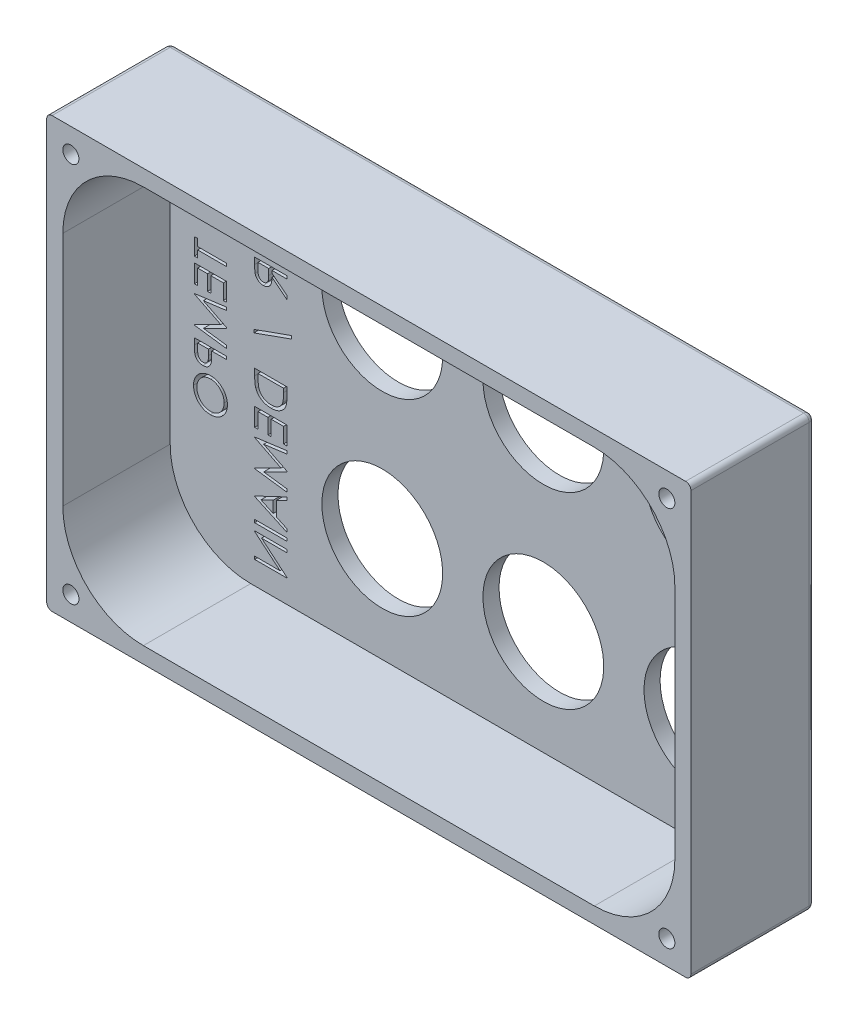
from build123d import *

# Parameters (mm, degrees)
ESQUISSE1_W             = 120
ESQUISSE1_H             = 80
BOSS_EXTRU_1_DEPTH      = 3
ESQUISSE4_W             = 120
ESQUISSE4_H             = 80
ESQUISSE4_W_2           = 114
ESQUISSE4_H_2           = 74
BOSS_EXTRU_3_DEPTH      = 20
CONG_1_R                = 15
ESQUISSE5_R             = 1.5
ENL_V_MAT_EXTRU_1_DEPTH = 15
ESQUISSE6_R             = 11.25
ESQUISSE6_W             = 6
ESQUISSE6_H             = 0.538461539
ENL_V_MAT_EXTRU_2_DEPTH = 147.044513762
CONG_2_R                = 1


with BuildPart() as part:
    # Esquisse1 → Boss.-Extru.1 (new body)
    with BuildSketch(Plane.XY):
        with Locations((60, 40)):
            Rectangle(ESQUISSE1_W, ESQUISSE1_H)
    extrude(amount=BOSS_EXTRU_1_DEPTH)

    # Esquisse4 → Boss.-Extru.3 (add)
    with BuildSketch(Plane.XY.offset(3)):
        with Locations((60, 40)):
            Rectangle(ESQUISSE4_W, ESQUISSE4_H)
        with Locations((60, 40)):
            Rectangle(ESQUISSE4_W_2, ESQUISSE4_H_2, mode=Mode.SUBTRACT)
    extrude(amount=BOSS_EXTRU_3_DEPTH)

    # Congé1
    cong_1_edges = [part.edges().sort_by_distance(p)[0] for p in [
        (3, 3, 13),
        (117, 3, 13),
        (117, 77, 13),
        (3, 77, 13),
    ]]
    fillet(cong_1_edges, radius=CONG_1_R)

    # Esquisse5 → Enlèv. mat.-Extru.1 (cut)
    with BuildSketch(Plane.XY.offset(23)):
        with Locations((4.5, 75.5)):
            Circle(ESQUISSE5_R)
        with Locations((115.5, 75.5)):
            Circle(ESQUISSE5_R)
        with Locations((115.5, 4.5)):
            Circle(ESQUISSE5_R)
        with Locations((4.5, 4.5)):
            Circle(ESQUISSE5_R)
    extrude(amount=-ENL_V_MAT_EXTRU_1_DEPTH, mode=Mode.SUBTRACT)

    # Esquisse6 → Enlèv. mat.-Extru.2 (cut, through all)
    # profile 1 of 22: a face of its own
    with BuildSketch(Plane(origin=(0, 0, 0), x_dir=(-1, 0, 0), z_dir=(0, 0, -1))):
        with Locations((-102.5, 57.5)):
            Circle(ESQUISSE6_R)
    # profile 2 of 22: a face of its own
    with BuildSketch(Plane(origin=(0, 0, 0), x_dir=(-1, 0, 0), z_dir=(0, 0, -1))):
        with Locations((-72.5, 57.5)):
            Circle(ESQUISSE6_R)
    # profile 3 of 22: a face of its own
    with BuildSketch(Plane(origin=(0, 0, 0), x_dir=(-1, 0, 0), z_dir=(0, 0, -1))):
        with Locations((-42.5, 57.5)):
            Circle(ESQUISSE6_R)
    # profile 4 of 22: a face of its own
    with BuildSketch(Plane(origin=(0, 0, 0), x_dir=(-1, 0, 0), z_dir=(0, 0, -1))):
        with Locations((-42.5, 22.5)):
            Circle(ESQUISSE6_R)
    # profile 5 of 22: a face of its own
    with BuildSketch(Plane(origin=(0, 0, 0), x_dir=(-1, 0, 0), z_dir=(0, 0, -1))):
        with Locations((-72.5, 22.5)):
            Circle(ESQUISSE6_R)
    # profile 6 of 22: a face of its own
    with BuildSketch(Plane(origin=(0, 0, 0), x_dir=(-1, 0, 0), z_dir=(0, 0, -1))):
        with Locations((-102.5, 22.5)):
            Circle(ESQUISSE6_R)
    # profile 7 of 22: a face of its own
    with BuildSketch(Plane(origin=(0, 0, 0), x_dir=(-1, 0, 0), z_dir=(0, 0, -1))):
        Polygon((-8.115384615, 53.730769231), (-7.5, 53.730769231), (-7.5, 50.576923077), (-8.115384615, 50.576923077), (-8.115384615, 51.884615385), (-13.5, 51.884615385), (-13.5, 52.423076923), (-8.115384615, 52.423076923), align=None)
    # profile 8 of 22: a face of its own
    with BuildSketch(Plane(origin=(0, 0, 0), x_dir=(-1, 0, 0), z_dir=(0, 0, -1))):
        Polygon((-7.5, 49.5), (-7.5, 46.115384615), (-8.115384615, 46.115384615), (-8.115384615, 48.961538462), (-9.961538462, 48.961538462), (-9.961538462, 46.115384615), (-10.576923077, 46.115384615), (-10.576923077, 48.961538462), (-12.884615385, 48.961538462), (-12.884615385, 46.115384615), (-13.5, 46.115384615), (-13.5, 49.5), align=None)
    # profile 9 of 22: a face of its own
    with BuildSketch(Plane(origin=(0, 0, 0), x_dir=(-1, 0, 0), z_dir=(0, 0, -1))):
        Polygon((-13.5, 45.346153846), (-7.5, 44.554086538), (-7.5, 44.477163462), (-12.423076923, 42), (-7.5, 39.528846154), (-7.5, 39.450721154), (-13.5, 38.653846154), (-13.5, 39.194711538), (-9.182692308, 39.769230769), (-13.5, 41.935096154), (-13.5, 42.056490385), (-9.173076923, 44.230769231), (-13.5, 44.804086538), align=None)
    # profile 10 of 22: a face of its own
    with BuildSketch(Plane(origin=(0, 0, 0), x_dir=(-1, 0, 0), z_dir=(0, 0, -1))):
        with BuildLine():
            Line((-7.5, 37.423076923), (-7.5, 36.246394231))
            add(Edge.make_bspline(
                [(-7.5, 36.246394231), (-7.500088965, 36.165461249), (-7.500259426, 36.010390061), (-7.505427562, 35.788021394), (-7.512330462, 35.586061854), (-7.521899422, 35.404946916), (-7.533207862, 35.244119319), (-7.549068501, 35.104306805), (-7.565629008, 34.984410423), (-7.582465705, 34.912570795), (-7.590144231, 34.879807692)],
                knots=[0, 0, 0, 0, 1.415646017, 2.712440637, 3.8905458, 4.950247383, 5.884950622, 6.709939814, 7.411656543, 8, 8, 8, 8], degree=3))
            add(Edge.make_bspline(
                [(-7.590144231, 34.879807692), (-7.601496043, 34.838332965), (-7.623932178, 34.756360811), (-7.668871455, 34.638246153), (-7.722149727, 34.525862874), (-7.78289659, 34.418856785), (-7.853597499, 34.318427058), (-7.932015981, 34.223288125), (-8.018108893, 34.132894297), (-8.11354521, 34.050316225), (-8.214806223, 33.974292507), (-8.324147069, 33.90907569), (-8.439187988, 33.853910872), (-8.561107138, 33.808858018), (-8.689163527, 33.77460047), (-8.823730992, 33.749289912), (-8.964347147, 33.733095902), (-9.060451825, 33.731554102), (-9.109375, 33.730769231)],
                knots=[0, 0, 0, 0, 0.999487232, 1.975422798, 2.933948774, 3.889618007, 4.832992075, 5.786114792, 6.754729845, 7.731954186, 8.717668599, 9.695514499, 10.68728626, 11.680675814, 12.71351902, 13.766008651, 14.862761406, 16, 16, 16, 16], degree=3))
            add(Edge.make_bspline(
                [(-9.109375, 33.730769231), (-9.158708332, 33.731491673), (-9.255232327, 33.73290518), (-9.396442821, 33.749870241), (-9.531388633, 33.772721998), (-9.659770548, 33.807859802), (-9.780826154, 33.853880956), (-9.896405409, 33.907867332), (-10.00454199, 33.972981956), (-10.105628477, 34.047801664), (-10.199759755, 34.131032969), (-10.286253688, 34.22232372), (-10.364603983, 34.321305364), (-10.434986286, 34.427663332), (-10.49576848, 34.542434502), (-10.550209574, 34.663878193), (-10.595931392, 34.793049993), (-10.619982926, 34.88243716), (-10.632211538, 34.927884615)],
                knots=[0, 0, 0, 0, 1.121902311, 2.195077645, 3.232258892, 4.234102512, 5.217864754, 6.176164875, 7.132989551, 8.084763148, 9.034132444, 9.988522005, 10.94243251, 11.903244335, 12.886203696, 13.894208494, 14.929344452, 16, 16, 16, 16], degree=3))
            add(Edge.make_bspline(
                [(-10.632211538, 34.927884615), (-10.64020522, 34.965474331), (-10.657723839, 35.047854378), (-10.677281193, 35.183527616), (-10.693974223, 35.341491134), (-10.706490459, 35.521529329), (-10.717205376, 35.723480594), (-10.725722109, 35.947454178), (-10.730401858, 36.193889739), (-10.730643217, 36.3657833), (-10.730769231, 36.455528846)],
                knots=[0, 0, 0, 0, 0.601384939, 1.31797006, 2.144135048, 3.087295005, 4.142315834, 5.309527816, 6.595305764, 8, 8, 8, 8], degree=3))
            Line((-10.730769231, 36.455528846), (-10.730769231, 36.884615385))
            Line((-10.730769231, 36.884615385), (-13.5, 36.884615385))
            Line((-13.5, 36.884615385), (-13.5, 37.423076923))
            Line((-13.5, 37.423076923), (-7.5, 37.423076923))
        make_face()
        with BuildLine():
            Line((-8.115384615, 36.884615385), (-10.115384615, 36.884615385))
            Line((-10.115384615, 36.884615385), (-10.128605769, 35.834134615))
            add(Edge.make_bspline(
                [(-10.128605769, 35.834134615), (-10.128637844, 35.782842812), (-10.128699765, 35.683825044), (-10.121774213, 35.540398765), (-10.114134866, 35.407673625), (-10.102171319, 35.285361393), (-10.086408222, 35.174396787), (-10.069250393, 35.073354503), (-10.046004948, 34.983713748), (-10.013592872, 34.878671196), (-9.959390835, 34.762019031), (-9.878687958, 34.635956406), (-9.778642135, 34.527390792), (-9.664610277, 34.434070495), (-9.537293276, 34.361747513), (-9.402140338, 34.307351409), (-9.259066419, 34.275665991), (-9.161208482, 34.271390426), (-9.111778846, 34.269230769)],
                knots=[0, 0, 0, 0, 1.160368111, 2.240066715, 3.248291599, 4.168343349, 5.019594299, 5.784185847, 6.485545725, 7.113397927, 8.269509094, 9.383373363, 10.487084095, 11.595623793, 12.704274681, 13.786671823, 14.88201193, 16, 16, 16, 16], degree=3))
            add(Edge.make_bspline(
                [(-9.111778846, 34.269230769), (-9.063545143, 34.271401959), (-8.967662511, 34.275718015), (-8.827072188, 34.307601341), (-8.693353171, 34.361641326), (-8.567603602, 34.434560567), (-8.45403842, 34.52520134), (-8.356250477, 34.631361039), (-8.276570475, 34.750871953), (-8.225496436, 34.862100272), (-8.194260192, 34.960836394), (-8.172414332, 35.046607594), (-8.154969664, 35.143448077), (-8.14084504, 35.25139305), (-8.128753319, 35.369604701), (-8.120548809, 35.499098975), (-8.115746306, 35.639385214), (-8.115508098, 35.736774765), (-8.115384615, 35.787259615)],
                knots=[0, 0, 0, 0, 1.120550889, 2.227516482, 3.330715807, 4.461473166, 5.594337325, 6.694900473, 7.802844763, 8.919519911, 9.52614448, 10.208195984, 10.975273469, 11.811520316, 12.738076669, 13.736566072, 14.826679847, 16, 16, 16, 16], degree=3))
            Line((-8.115384615, 35.787259615), (-8.115384615, 36.884615385))
        make_face(mode=Mode.SUBTRACT)
    # profile 11 of 22: a face of its own
    with BuildSketch(Plane(origin=(0, 0, 0), x_dir=(-1, 0, 0), z_dir=(0, 0, -1))):
        with BuildLine():
            add(Edge.make_bspline(
                [(-7.346153846, 29.692307692), (-7.348967836, 29.581208105), (-7.354494745, 29.362999348), (-7.396801416, 29.042299206), (-7.469994848, 28.736137349), (-7.567469376, 28.442012866), (-7.697523453, 28.163469156), (-7.854630567, 27.89831514), (-8.04102515, 27.647300508), (-8.253579589, 27.412726113), (-8.485690502, 27.198856319), (-8.734108761, 27.011999753), (-8.995432666, 26.854013938), (-9.270571555, 26.724524044), (-9.558314443, 26.622846137), (-9.860297385, 26.552705516), (-10.174536154, 26.507895534), (-10.388868097, 26.502657296), (-10.497596154, 26.5)],
                knots=[0, 0, 0, 0, 1.06508495, 2.091914715, 3.094501328, 4.079693967, 5.057647778, 6.035986298, 7.030177474, 8.050107388, 9.066943579, 10.051896531, 11.025616101, 11.9896488, 12.96281505, 13.945825876, 14.957941789, 16, 16, 16, 16], degree=3))
            add(Edge.make_bspline(
                [(-10.497596154, 26.5), (-10.605523298, 26.502656902), (-10.818260202, 26.507893964), (-11.130504772, 26.552756517), (-11.430665151, 26.623105942), (-11.718211115, 26.723580853), (-11.993554116, 26.852448678), (-12.255358361, 27.011502246), (-12.505496693, 27.197121701), (-12.738734399, 27.410252272), (-12.953024337, 27.642307833), (-13.140171415, 27.891426614), (-13.30010241, 28.152493337), (-13.428704145, 28.427465899), (-13.531101653, 28.713278811), (-13.600981957, 29.012551538), (-13.646040377, 29.323948698), (-13.651215677, 29.536298567), (-13.653846154, 29.644230769)],
                knots=[0, 0, 0, 0, 1.04355943, 2.056976533, 3.044937463, 4.02179873, 4.997890911, 5.980248884, 6.980147982, 8.006253959, 9.032111064, 10.031228745, 11.015595249, 11.988180414, 12.962670953, 13.946861971, 14.95644057, 16, 16, 16, 16], degree=3))
            add(Edge.make_bspline(
                [(-13.653846154, 29.644230769), (-13.651190419, 29.752958386), (-13.645955257, 29.967289461), (-13.601067738, 30.28192133), (-13.530901389, 30.584122927), (-13.430530934, 30.872963777), (-13.301302242, 31.148538667), (-13.142499372, 31.410820942), (-12.955371999, 31.660125779), (-12.742525183, 31.893916209), (-12.510358099, 32.107569058), (-12.262876787, 32.295489076), (-12.002434938, 32.453376415), (-11.730106142, 32.582659659), (-11.446594322, 32.684917783), (-11.150116082, 32.754703934), (-10.842332752, 32.799849527), (-10.632773679, 32.805052362), (-10.526442308, 32.807692308)],
                knots=[0, 0, 0, 0, 1.053167129, 2.076072758, 3.073341244, 4.055601477, 5.033424535, 6.017524495, 7.021518915, 8.049444456, 9.077120685, 10.074910483, 11.055688766, 12.022980584, 12.991883888, 13.970269434, 14.970104079, 16, 16, 16, 16], degree=3))
            add(Edge.make_bspline(
                [(-10.526442308, 32.807692308), (-10.455071692, 32.80677663), (-10.313230832, 32.804956827), (-10.102607174, 32.783015845), (-9.895348058, 32.751242131), (-9.692150191, 32.705467222), (-9.492980389, 32.646421472), (-9.298245967, 32.573657603), (-9.106342885, 32.490270181), (-8.920923398, 32.390985936), (-8.741696478, 32.282663854), (-8.570903209, 32.164549507), (-8.411594419, 32.035819346), (-8.261210272, 31.898312253), (-8.122317482, 31.75012482), (-7.991887868, 31.593487265), (-7.871271588, 31.427579987), (-7.763001917, 31.252140601), (-7.663554909, 31.071642), (-7.58052484, 30.884774659), (-7.507137395, 30.695481289), (-7.448816138, 30.502094522), (-7.402403735, 30.305061692), (-7.370867679, 30.104136488), (-7.348877946, 29.899525858), (-7.347065786, 29.761677599), (-7.346153846, 29.692307692)],
                knots=[0, 0, 0, 0, 1.037115869, 2.061148057, 3.07517727, 4.084041727, 5.086514338, 6.092668487, 7.104487461, 8.125783165, 9.147610153, 10.147694368, 11.141876323, 12.122903372, 13.107606018, 14.091946891, 15.084523921, 16.086505767, 17.087268121, 18.077809654, 19.05670789, 20.036870126, 21.011670792, 21.99694167, 22.991993299, 24, 24, 24, 24], degree=3))
        make_face()
        with BuildLine():
            add(Edge.make_bspline(
                [(-7.961538462, 29.665865385), (-7.962232229, 29.722804886), (-7.963613131, 29.836139544), (-7.981816386, 30.004625399), (-8.007734943, 30.170904521), (-8.044800467, 30.334967862), (-8.09483758, 30.495932534), (-8.153795643, 30.655405988), (-8.223150871, 30.812622488), (-8.304020792, 30.965824466), (-8.392362399, 31.114755844), (-8.489320375, 31.256253045), (-8.594424575, 31.388904538), (-8.706286643, 31.513135253), (-8.826044733, 31.628583185), (-8.951787496, 31.737588541), (-9.087134746, 31.835764155), (-9.228409419, 31.925739649), (-9.375429355, 32.006255888), (-9.52664624, 32.077853654), (-9.683293709, 32.136420522), (-9.843672263, 32.184184597), (-10.007527908, 32.223784272), (-10.176103649, 32.248871), (-10.348552413, 32.26726933), (-10.465092734, 32.268571922), (-10.524038462, 32.269230769)],
                knots=[0, 0, 0, 0, 1.008585988, 2.007529826, 2.999688727, 3.990042337, 4.984966365, 5.984641633, 7.001812546, 8.027570247, 9.052811818, 10.068991095, 11.064725446, 12.050001529, 13.029093193, 14.010961114, 14.996492974, 15.989185205, 16.977398719, 17.96520407, 18.951579521, 19.937648295, 20.929603947, 21.935788061, 22.955928099, 24, 24, 24, 24], degree=3))
            add(Edge.make_bspline(
                [(-10.524038462, 32.269230769), (-10.610716554, 32.267045292), (-10.781239178, 32.262745781), (-11.031127424, 32.225104232), (-11.271278772, 32.167123705), (-11.500379188, 32.081653934), (-11.720397959, 31.974767166), (-11.929383281, 31.842721068), (-12.127391637, 31.686276921), (-12.31304067, 31.508568018), (-12.48249062, 31.314300521), (-12.631227892, 31.108015842), (-12.757074034, 30.891923943), (-12.859597016, 30.66546131), (-12.940836566, 30.429836957), (-12.996514219, 30.183532584), (-13.033157857, 29.928188939), (-13.036676867, 29.754136387), (-13.038461538, 29.665865385)],
                knots=[0, 0, 0, 0, 1.032063989, 2.030389145, 3.003944642, 3.970395727, 4.937377036, 5.913328081, 6.909231446, 7.93887556, 8.970685674, 9.976071282, 10.964166581, 11.944589148, 12.933237628, 13.927779006, 14.949070134, 16, 16, 16, 16], degree=3))
            add(Edge.make_bspline(
                [(-13.038461538, 29.665865385), (-13.037646391, 29.606534809), (-13.036029707, 29.488864457), (-13.019746226, 29.313843587), (-12.993634582, 29.141975702), (-12.956038684, 28.973502423), (-12.908988136, 28.808612903), (-12.853082449, 28.646626548), (-12.783368568, 28.489240219), (-12.706219406, 28.33457633), (-12.61890147, 28.186505288), (-12.523298773, 28.046021848), (-12.420074246, 27.913940451), (-12.309183571, 27.789975016), (-12.191582657, 27.67372716), (-12.06424779, 27.568353497), (-11.930897732, 27.469001755), (-11.789293536, 27.379386534), (-11.641963787, 27.299030375), (-11.490174112, 27.229155712), (-11.334446162, 27.169839473), (-11.174515996, 27.121964356), (-11.010697873, 27.084445795), (-10.84276961, 27.058594674), (-10.671067915, 27.04051159), (-10.554935586, 27.039148607), (-10.496394231, 27.038461538)],
                knots=[0, 0, 0, 0, 1.047226202, 2.076964084, 3.100341814, 4.114585567, 5.122123135, 6.126552355, 7.137064942, 8.158803602, 9.176592812, 10.169297945, 11.156925011, 12.133779169, 13.104132798, 14.073170763, 15.049307625, 16.038276215, 17.028988595, 18.010110019, 18.986169996, 19.968539974, 20.955178716, 21.950601663, 22.966915103, 24, 24, 24, 24], degree=3))
            add(Edge.make_bspline(
                [(-10.496394231, 27.038461538), (-10.438253366, 27.039149161), (-10.322920252, 27.040513186), (-10.152415992, 27.058586), (-9.985696201, 27.08447324), (-9.823415395, 27.12178074), (-9.66553221, 27.169866718), (-9.512194928, 27.229159284), (-9.362832308, 27.29907694), (-9.217813513, 27.379319611), (-9.078656819, 27.469518165), (-8.945624113, 27.568079725), (-8.821213695, 27.676706035), (-8.702354236, 27.792293511), (-8.591580649, 27.917729297), (-8.488856565, 28.052445297), (-8.391701476, 28.194805629), (-8.304061118, 28.345539024), (-8.223109473, 28.501096378), (-8.153812628, 28.660733966), (-8.094582595, 28.822923008), (-8.045005279, 28.986833102), (-8.007698629, 29.153618929), (-7.981825685, 29.322309226), (-7.963611181, 29.493192326), (-7.962231561, 29.608125048), (-7.961538462, 29.665865385)],
                knots=[0, 0, 0, 0, 1.029967493, 2.04313025, 3.035375922, 4.01889446, 4.991458755, 5.958017022, 6.930036849, 7.912118993, 8.892942568, 9.867138445, 10.843712051, 11.817804417, 12.803729339, 13.806387533, 14.818654169, 15.856205545, 16.894655496, 17.924916651, 18.938004761, 19.953404357, 20.957695443, 21.963967554, 22.97713031, 24, 24, 24, 24], degree=3))
        make_face(mode=Mode.SUBTRACT)
    # profile 12 of 22: a face of its own
    with BuildSketch(Plane(origin=(0, 0, 0), x_dir=(-1, 0, 0), z_dir=(0, 0, -1))):
        with BuildLine():
            Line((-18.730769231, 70.807692308), (-18.730769231, 70.269230769))
            Line((-18.730769231, 70.269230769), (-22.782451923, 70.269230769))
            add(Edge.make_bspline(
                [(-22.782451923, 70.269230769), (-22.857375659, 70.269764387), (-23.001238373, 70.270788999), (-23.208443057, 70.276530478), (-23.397675642, 70.286846261), (-23.5691735, 70.302798821), (-23.722906187, 70.321178039), (-23.859385065, 70.345020955), (-23.977932339, 70.373213188), (-24.110982869, 70.415919645), (-24.257384903, 70.485556841), (-24.41423426, 70.592327354), (-24.552555077, 70.722768424), (-24.672227919, 70.87425159), (-24.767660981, 71.047605774), (-24.836149807, 71.239439783), (-24.877930035, 71.448522981), (-24.882342215, 71.593550539), (-24.884615385, 71.668269231)],
                knots=[0, 0, 0, 0, 1.237549021, 2.376245131, 3.423509879, 4.367128923, 5.220764738, 5.980167839, 6.654279555, 7.23186528, 8.285695362, 9.319068926, 10.353713031, 11.414109097, 12.495220016, 13.606748513, 14.766988686, 16, 16, 16, 16], degree=3))
            add(Edge.make_bspline(
                [(-24.884615385, 71.668269231), (-24.882822601, 71.726893917), (-24.879239886, 71.844049987), (-24.848267577, 72.018648468), (-24.802341071, 72.192344946), (-24.732894821, 72.366297076), (-24.640042343, 72.544184019), (-24.517936463, 72.728569956), (-24.367391164, 72.921646672), (-24.252465904, 73.048816777), (-24.192307692, 73.115384615)],
                knots=[0, 0, 0, 0, 0.854372818, 1.707385869, 2.579105618, 3.471016644, 4.432770875, 5.500780854, 6.691771033, 8, 8, 8, 8], degree=3))
            Line((-24.192307692, 73.115384615), (-23.730769231, 72.798076923))
            add(Edge.make_bspline(
                [(-23.730769231, 72.798076923), (-23.781156652, 72.724815858), (-23.87610123, 72.586770672), (-23.999912408, 72.384330377), (-24.103982359, 72.203720172), (-24.157828637, 72.085731569), (-24.182692308, 72.03125)],
                knots=[0, 0, 0, 0, 1.196704426, 2.25493972, 3.19421351, 4, 4, 4, 4], degree=3))
            add(Edge.make_bspline(
                [(-24.182692308, 72.03125), (-24.195651377, 71.99819118), (-24.221066999, 71.933355473), (-24.249431396, 71.834226765), (-24.26493267, 71.735663844), (-24.267814956, 71.670319226), (-24.269230769, 71.638221154)],
                knots=[0, 0, 0, 0, 1.051806502, 2.062826769, 3.048436908, 4, 4, 4, 4], degree=3))
            add(Edge.make_bspline(
                [(-24.269230769, 71.638221154), (-24.267532591, 71.59674959), (-24.26419188, 71.51516539), (-24.232921703, 71.396309411), (-24.18707575, 71.282061747), (-24.118281164, 71.17713094), (-24.037012943, 71.080656425), (-23.938726656, 71.000910616), (-23.829429032, 70.934974319), (-23.726795304, 70.893304171), (-23.632462527, 70.868173368), (-23.546145586, 70.851527924), (-23.44483348, 70.839481482), (-23.329164159, 70.826502415), (-23.198343926, 70.819510954), (-23.052974858, 70.811356469), (-22.892638423, 70.80845372), (-22.780848642, 70.807953856), (-22.722355769, 70.807692308)],
                knots=[0, 0, 0, 0, 0.99710849, 1.961544003, 2.943780681, 3.950512064, 4.9701611, 5.971139155, 6.984143068, 8.036211364, 8.626223178, 9.334153146, 10.151809154, 11.083375733, 12.13756692, 13.306844995, 14.590833851, 16, 16, 16, 16], degree=3))
            Line((-22.722355769, 70.807692308), (-18.730769231, 70.807692308))
        make_face()
    # profile 13 of 22: a face of its own
    with BuildSketch(Plane(origin=(0, 0, 0), x_dir=(-1, 0, 0), z_dir=(0, 0, -1))):
        with BuildLine():
            add(Edge.make_bspline(
                [(-18.576923077, 65.923076923), (-18.579737067, 65.811977335), (-18.585263976, 65.593768579), (-18.627570647, 65.273068436), (-18.700764079, 64.96690658), (-18.798238607, 64.672782097), (-18.928292684, 64.394238387), (-19.085399797, 64.129084371), (-19.271794381, 63.878069739), (-19.48434882, 63.643495343), (-19.716459733, 63.429625549), (-19.964877992, 63.242768984), (-20.226201897, 63.084783169), (-20.501340786, 62.955293274), (-20.789083674, 62.853615367), (-21.091066615, 62.783474747), (-21.405305385, 62.738664765), (-21.619637328, 62.733426527), (-21.728365385, 62.730769231)],
                knots=[0, 0, 0, 0, 1.06508495, 2.091914715, 3.094501328, 4.079693967, 5.057647778, 6.035986298, 7.030177474, 8.050107388, 9.066943579, 10.051896531, 11.025616101, 11.9896488, 12.96281505, 13.945825876, 14.957941789, 16, 16, 16, 16], degree=3))
            add(Edge.make_bspline(
                [(-21.728365385, 62.730769231), (-21.836292529, 62.733426133), (-22.049029433, 62.738663195), (-22.361274003, 62.783525747), (-22.661434382, 62.853875173), (-22.948980346, 62.954350084), (-23.224323346, 63.083217908), (-23.486127591, 63.242271477), (-23.736265924, 63.427890931), (-23.96950363, 63.641021503), (-24.183793568, 63.873077064), (-24.370940646, 64.122195845), (-24.530871641, 64.383262568), (-24.659473376, 64.65823513), (-24.761870884, 64.944048042), (-24.831751188, 65.243320769), (-24.876809608, 65.554717929), (-24.881984907, 65.767067798), (-24.884615385, 65.875)],
                knots=[0, 0, 0, 0, 1.04355943, 2.056976533, 3.044937463, 4.02179873, 4.997890911, 5.980248884, 6.980147982, 8.006253959, 9.032111064, 10.031228745, 11.015595249, 11.988180414, 12.962670953, 13.946861971, 14.95644057, 16, 16, 16, 16], degree=3))
            add(Edge.make_bspline(
                [(-24.884615385, 65.875), (-24.881959649, 65.983727617), (-24.876724488, 66.198058692), (-24.831836969, 66.512690561), (-24.761670619, 66.814892158), (-24.661300165, 67.103733008), (-24.532071473, 67.379307897), (-24.373268603, 67.641590173), (-24.18614123, 67.890895009), (-23.973294414, 68.12468544), (-23.741127329, 68.338338289), (-23.493646018, 68.526258307), (-23.233204169, 68.684145645), (-22.960875373, 68.81342889), (-22.677363552, 68.915687014), (-22.380885312, 68.985473165), (-22.073101983, 69.030618758), (-21.86354291, 69.035821593), (-21.757211538, 69.038461538)],
                knots=[0, 0, 0, 0, 1.053167129, 2.076072758, 3.073341244, 4.055601477, 5.033424535, 6.017524495, 7.021518915, 8.049444456, 9.077120685, 10.074910483, 11.055688766, 12.022980584, 12.991883888, 13.970269434, 14.970104079, 16, 16, 16, 16], degree=3))
            add(Edge.make_bspline(
                [(-21.757211538, 69.038461538), (-21.685840922, 69.037545861), (-21.544000062, 69.035726057), (-21.333376404, 69.013785076), (-21.126117289, 68.982011361), (-20.922919422, 68.936236452), (-20.72374962, 68.877190703), (-20.529015198, 68.804426834), (-20.337112115, 68.721039412), (-20.151692629, 68.621755167), (-19.972465709, 68.513433085), (-19.80167244, 68.395318737), (-19.64236365, 68.266588577), (-19.491979502, 68.129081484), (-19.353086713, 67.980894051), (-19.222657099, 67.824256495), (-19.102040819, 67.658349218), (-18.993771148, 67.482909832), (-18.894324139, 67.302411231), (-18.811294071, 67.115543889), (-18.737906626, 66.92625052), (-18.679585369, 66.732863753), (-18.633172965, 66.535830923), (-18.60163691, 66.334905718), (-18.579647176, 66.130295089), (-18.577835017, 65.99244683), (-18.576923077, 65.923076923)],
                knots=[0, 0, 0, 0, 1.037115869, 2.061148057, 3.07517727, 4.084041727, 5.086514338, 6.092668487, 7.104487461, 8.125783165, 9.147610153, 10.147694368, 11.141876323, 12.122903372, 13.107606018, 14.091946891, 15.084523921, 16.086505767, 17.087268121, 18.077809654, 19.05670789, 20.036870126, 21.011670792, 21.99694167, 22.991993299, 24, 24, 24, 24], degree=3))
        make_face()
        with BuildLine():
            add(Edge.make_bspline(
                [(-19.192307692, 65.896634615), (-19.193001459, 65.953574117), (-19.194382361, 66.066908775), (-19.212585616, 66.23539463), (-19.238504174, 66.401673752), (-19.275569698, 66.565737093), (-19.325606811, 66.726701765), (-19.384564874, 66.886175219), (-19.453920101, 67.043391719), (-19.534790023, 67.196593697), (-19.62313163, 67.345525075), (-19.720089605, 67.487022276), (-19.825193805, 67.619673769), (-19.937055874, 67.743904484), (-20.056813964, 67.859352416), (-20.182556727, 67.968357772), (-20.317903977, 68.066533386), (-20.459178649, 68.156508879), (-20.606198586, 68.237025118), (-20.75741547, 68.308622885), (-20.914062939, 68.367189753), (-21.074441494, 68.414953828), (-21.238297139, 68.454553503), (-21.40687288, 68.47964023), (-21.579321644, 68.498038561), (-21.695861965, 68.499341153), (-21.754807692, 68.5)],
                knots=[0, 0, 0, 0, 1.008585988, 2.007529826, 2.999688727, 3.990042337, 4.984966365, 5.984641633, 7.001812546, 8.027570247, 9.052811818, 10.068991095, 11.064725446, 12.050001529, 13.029093193, 14.010961114, 14.996492974, 15.989185205, 16.977398719, 17.96520407, 18.951579521, 19.937648295, 20.929603947, 21.935788061, 22.955928099, 24, 24, 24, 24], degree=3))
            add(Edge.make_bspline(
                [(-21.754807692, 68.5), (-21.841485785, 68.497814522), (-22.012008408, 68.493515012), (-22.261896655, 68.455873463), (-22.502048003, 68.397892935), (-22.731148419, 68.312423164), (-22.95116719, 68.205536396), (-23.160152512, 68.073490299), (-23.358160868, 67.917046152), (-23.5438099, 67.739337249), (-23.713259851, 67.545069752), (-23.861997123, 67.338785072), (-23.987843265, 67.122693174), (-24.090366246, 66.896230541), (-24.171605797, 66.660606188), (-24.22728345, 66.414301815), (-24.263927088, 66.15895817), (-24.267446098, 65.984905618), (-24.269230769, 65.896634615)],
                knots=[0, 0, 0, 0, 1.032063989, 2.030389145, 3.003944642, 3.970395727, 4.937377036, 5.913328081, 6.909231446, 7.93887556, 8.970685674, 9.976071282, 10.964166581, 11.944589148, 12.933237628, 13.927779006, 14.949070134, 16, 16, 16, 16], degree=3))
            add(Edge.make_bspline(
                [(-24.269230769, 65.896634615), (-24.268415621, 65.837304039), (-24.266798938, 65.719633688), (-24.250515457, 65.544612817), (-24.224403813, 65.372744933), (-24.186807915, 65.204271654), (-24.139757367, 65.039382134), (-24.08385168, 64.877395778), (-24.014137799, 64.720009449), (-23.936988637, 64.565345561), (-23.8496707, 64.417274518), (-23.754068004, 64.276791079), (-23.650843477, 64.144709682), (-23.539952802, 64.020744247), (-23.422351888, 63.90449639), (-23.29501702, 63.799122728), (-23.161666963, 63.699770986), (-23.020062767, 63.610155764), (-22.872733018, 63.529799606), (-22.720943343, 63.459924943), (-22.565215392, 63.400608704), (-22.405285227, 63.352733587), (-22.241467104, 63.315215026), (-22.073538841, 63.289363905), (-21.901837146, 63.271280821), (-21.785704816, 63.269917838), (-21.727163462, 63.269230769)],
                knots=[0, 0, 0, 0, 1.047226202, 2.076964084, 3.100341814, 4.114585567, 5.122123135, 6.126552355, 7.137064942, 8.158803602, 9.176592812, 10.169297945, 11.156925011, 12.133779169, 13.104132798, 14.073170763, 15.049307625, 16.038276215, 17.028988595, 18.010110019, 18.986169996, 19.968539974, 20.955178716, 21.950601663, 22.966915103, 24, 24, 24, 24], degree=3))
            add(Edge.make_bspline(
                [(-21.727163462, 63.269230769), (-21.669022597, 63.269918391), (-21.553689482, 63.271282417), (-21.383185222, 63.289355231), (-21.216465431, 63.315242471), (-21.054184626, 63.352549971), (-20.89630144, 63.400635948), (-20.742964159, 63.459928515), (-20.593601538, 63.529846171), (-20.448582744, 63.610088841), (-20.30942605, 63.700287396), (-20.176393344, 63.798848956), (-20.051982926, 63.907475266), (-19.933123466, 64.023062742), (-19.822349879, 64.148498528), (-19.719625795, 64.283214528), (-19.622470707, 64.42557486), (-19.534830348, 64.576308254), (-19.453878703, 64.731865609), (-19.384581858, 64.891503197), (-19.325351826, 65.053692239), (-19.275774509, 65.217602333), (-19.23846786, 65.38438816), (-19.212594915, 65.553078456), (-19.194380412, 65.723961557), (-19.193000791, 65.838894279), (-19.192307692, 65.896634615)],
                knots=[0, 0, 0, 0, 1.029967493, 2.04313025, 3.035375922, 4.01889446, 4.991458755, 5.958017022, 6.930036849, 7.912118993, 8.892942568, 9.867138445, 10.843712051, 11.817804417, 12.803729339, 13.806387533, 14.818654169, 15.856205545, 16.894655496, 17.924916651, 18.938004761, 19.953404357, 20.957695443, 21.963967554, 22.97713031, 24, 24, 24, 24], degree=3))
        make_face(mode=Mode.SUBTRACT)
    # profile 14 of 22: a face of its own
    with BuildSketch(Plane(origin=(0, 0, 0), x_dir=(-1, 0, 0), z_dir=(0, 0, -1))):
        with BuildLine():
            Line((-18.730769231, 61.5), (-18.730769231, 60.961538462))
            Line((-18.730769231, 60.961538462), (-22.325721154, 60.961538462))
            add(Edge.make_bspline(
                [(-22.325721154, 60.961538462), (-22.376602415, 60.961618594), (-22.473158377, 60.961770659), (-22.610589749, 60.960754921), (-22.732771107, 60.95791029), (-22.840173418, 60.956116873), (-22.932303842, 60.952127159), (-23.009661517, 60.948873364), (-23.07188015, 60.944689553), (-23.108190309, 60.939661351), (-23.123798077, 60.9375)],
                knots=[0, 0, 0, 0, 1.528628734, 2.90083645, 4.128790002, 5.200304208, 6.127813768, 6.898992206, 7.526736466, 8, 8, 8, 8], degree=3))
            add(Edge.make_bspline(
                [(-23.123798077, 60.9375), (-23.180111691, 60.928632972), (-23.289565848, 60.91139854), (-23.445341899, 60.867315458), (-23.586215231, 60.806245371), (-23.714995388, 60.731889141), (-23.829767815, 60.636265257), (-23.936323177, 60.522453822), (-24.028379469, 60.383277175), (-24.113070802, 60.228622111), (-24.181043021, 60.061825847), (-24.23246672, 59.89141213), (-24.263800323, 59.719908457), (-24.267428892, 59.605092361), (-24.269230769, 59.548076923)],
                knots=[0, 0, 0, 0, 1.035924841, 2.013479024, 2.933602255, 3.82183108, 4.706948133, 5.639927629, 6.646101806, 7.731477349, 8.84205456, 9.913728764, 10.963998332, 12, 12, 12, 12], degree=3))
            add(Edge.make_bspline(
                [(-24.269230769, 59.548076923), (-24.267389985, 59.499127565), (-24.263719048, 59.401511568), (-24.240983651, 59.256473295), (-24.200017037, 59.115210917), (-24.147126929, 58.97705748), (-24.077355228, 58.847470543), (-23.996199206, 58.726542847), (-23.902394611, 58.617460456), (-23.797102994, 58.519088543), (-23.679387041, 58.432959322), (-23.549601427, 58.360288536), (-23.408172798, 58.299040992), (-23.308445275, 58.269025727), (-23.257211538, 58.253605769)],
                knots=[0, 0, 0, 0, 0.994510594, 1.983277156, 2.972612928, 3.9776239, 4.982470102, 5.955333794, 6.930747147, 7.898149105, 8.876444039, 9.885893618, 10.913904934, 12, 12, 12, 12], degree=3))
            add(Edge.make_bspline(
                [(-23.257211538, 58.253605769), (-23.236042554, 58.248462697), (-23.188869525, 58.23700186), (-23.109118741, 58.22629264), (-23.015022689, 58.215138597), (-22.905905295, 58.207399334), (-22.7821322, 58.199854385), (-22.643058615, 58.195340546), (-22.48918954, 58.193254203), (-22.381811548, 58.192632466), (-22.325721154, 58.192307692)],
                knots=[0, 0, 0, 0, 0.558680831, 1.244966039, 2.062412453, 2.990489873, 4.051219941, 5.244515665, 6.560634259, 8, 8, 8, 8], degree=3))
            Line((-22.325721154, 58.192307692), (-18.730769231, 58.192307692))
            Line((-18.730769231, 58.192307692), (-18.730769231, 57.653846154))
            Line((-18.730769231, 57.653846154), (-22.354567308, 57.653846154))
            add(Edge.make_bspline(
                [(-22.354567308, 57.653846154), (-22.419879517, 57.654276976), (-22.547340265, 57.655117752), (-22.734104261, 57.662557027), (-22.911315287, 57.674075692), (-23.078747232, 57.691489416), (-23.236599483, 57.710713541), (-23.384641419, 57.738219373), (-23.523865698, 57.766973645), (-23.654033947, 57.803344492), (-23.776868426, 57.847219727), (-23.895608998, 57.898589311), (-24.009285, 57.961447297), (-24.119538215, 58.033176853), (-24.226519685, 58.112816253), (-24.327717052, 58.204610388), (-24.426448072, 58.303806785), (-24.519454781, 58.412494978), (-24.60535634, 58.528732589), (-24.679248862, 58.652726092), (-24.744130728, 58.78197875), (-24.795381133, 58.917874967), (-24.835049163, 59.05952959), (-24.864242046, 59.206935298), (-24.880896281, 59.360593364), (-24.883365174, 59.465105458), (-24.884615385, 59.518028846)],
                knots=[0, 0, 0, 0, 1.316364231, 2.568964831, 3.766826305, 4.894964518, 5.961692026, 6.970710131, 7.928946231, 8.826316495, 9.692177228, 10.556379512, 11.43093279, 12.306715499, 13.20629939, 14.115652445, 15.057829886, 16.025681089, 16.996391533, 17.967202739, 18.931442607, 19.907779629, 20.889445314, 21.893507297, 22.933303057, 24, 24, 24, 24], degree=3))
            add(Edge.make_bspline(
                [(-24.884615385, 59.518028846), (-24.883270073, 59.575747308), (-24.880630576, 59.688990723), (-24.865505861, 59.855855981), (-24.837017185, 60.015823175), (-24.800742996, 60.170581821), (-24.750713732, 60.318024959), (-24.692259804, 60.460128007), (-24.620470215, 60.594457174), (-24.540595827, 60.72319168), (-24.450725018, 60.842891262), (-24.352770434, 60.952772525), (-24.248301216, 61.053016874), (-24.136186303, 61.14193464), (-24.017297663, 61.220999013), (-23.891298966, 61.28910795), (-23.758238995, 61.347587798), (-23.665747795, 61.377770484), (-23.618990385, 61.393028846)],
                knots=[0, 0, 0, 0, 1.13879206, 2.234305948, 3.301075583, 4.341971843, 5.366689343, 6.369221514, 7.369726634, 8.367512178, 9.355451585, 10.318319045, 11.268648973, 12.207971039, 13.137398894, 14.081662264, 15.030215811, 16, 16, 16, 16], degree=3))
            add(Edge.make_bspline(
                [(-23.618990385, 61.393028846), (-23.587048828, 61.401903974), (-23.517766882, 61.421154325), (-23.40310433, 61.441769121), (-23.271078757, 61.459098976), (-23.121681125, 61.475394218), (-22.95479564, 61.485009575), (-22.770494641, 61.49343947), (-22.568555278, 61.500059388), (-22.427890394, 61.500020349), (-22.354567308, 61.5)],
                knots=[0, 0, 0, 0, 0.625038921, 1.35572334, 2.194682327, 3.136881307, 4.189498639, 5.346923369, 6.617055217, 8, 8, 8, 8], degree=3))
            Line((-22.354567308, 61.5), (-18.730769231, 61.5))
        make_face()
    # profile 15 of 22: a face of its own
    with BuildSketch(Plane(origin=(0, 0, 0), x_dir=(-1, 0, 0), z_dir=(0, 0, -1))):
        with BuildLine():
            Line((-18.730769231, 56.038461538), (-18.730769231, 54.837740385))
            add(Edge.make_bspline(
                [(-18.730769231, 54.837740385), (-18.73103595, 54.757612736), (-18.731548079, 54.603758774), (-18.734403673, 54.383347453), (-18.742588283, 54.18307243), (-18.749631569, 54.00303842), (-18.762474897, 53.843248725), (-18.774750292, 53.70321337), (-18.790819424, 53.583577317), (-18.805743007, 53.511155858), (-18.8125, 53.478365385)],
                knots=[0, 0, 0, 0, 1.410062039, 2.707475311, 3.878576406, 4.937260626, 5.877586885, 6.699081471, 7.410979367, 8, 8, 8, 8], degree=3))
            add(Edge.make_bspline(
                [(-18.8125, 53.478365385), (-18.823344653, 53.434467541), (-18.844802613, 53.347608315), (-18.890179779, 53.222562277), (-18.942604709, 53.103353479), (-19.004657665, 52.990429278), (-19.075256312, 52.883779197), (-19.154813131, 52.783562922), (-19.243733275, 52.690353417), (-19.339746098, 52.60343348), (-19.44368934, 52.524643354), (-19.55404883, 52.456460809), (-19.670134334, 52.398076438), (-19.792350105, 52.351466439), (-19.919663009, 52.313970124), (-20.053184727, 52.287522721), (-20.192318362, 52.271664212), (-20.28721756, 52.27004951), (-20.335336538, 52.269230769)],
                knots=[0, 0, 0, 0, 1.02737288, 2.032829108, 3.019628684, 3.985738875, 4.958353778, 5.924249254, 6.890702889, 7.883913451, 8.865824512, 9.85161466, 10.829249435, 11.81541824, 12.821369441, 13.843154991, 14.906364023, 16, 16, 16, 16], degree=3))
            add(Edge.make_bspline(
                [(-20.335336538, 52.269230769), (-20.415282524, 52.271748986), (-20.571277849, 52.27666268), (-20.797666646, 52.322478057), (-21.008853027, 52.397520181), (-21.204543094, 52.500943832), (-21.381025415, 52.632588845), (-21.535511309, 52.790796214), (-21.665981686, 52.974757986), (-21.755495864, 53.146818366), (-21.813093122, 53.298879595), (-21.853822206, 53.424433315), (-21.884759881, 53.561495196), (-21.912877904, 53.708098878), (-21.934334215, 53.865376741), (-21.949572273, 54.033012068), (-21.959370461, 54.211424123), (-21.960802018, 54.333720858), (-21.961538462, 54.396634615)],
                knots=[0, 0, 0, 0, 1.260402266, 2.459371274, 3.627181936, 4.786749125, 5.93865593, 7.087644312, 8.261344208, 9.485713728, 10.136162886, 10.825977872, 11.566646758, 12.35154167, 13.181268117, 14.0701832, 15.007234106, 16, 16, 16, 16], degree=3))
            Line((-21.961538462, 54.396634615), (-24.730769231, 52.192307692))
            Line((-24.730769231, 52.192307692), (-24.730769231, 52.858173077))
            Line((-24.730769231, 52.858173077), (-21.961538462, 55.0625))
            Line((-21.961538462, 55.0625), (-21.961538462, 55.5))
            Line((-21.961538462, 55.5), (-24.730769231, 55.5))
            Line((-24.730769231, 55.5), (-24.730769231, 56.038461538))
            Line((-24.730769231, 56.038461538), (-18.730769231, 56.038461538))
        make_face()
        with BuildLine():
            Line((-19.346153846, 55.5), (-21.346153846, 55.5))
            Line((-21.346153846, 55.5), (-21.354567308, 54.401442308))
            add(Edge.make_bspline(
                [(-21.354567308, 54.401442308), (-21.354589999, 54.350150813), (-21.354633981, 54.250733287), (-21.34778751, 54.106903573), (-21.339998957, 53.972983391), (-21.328085818, 53.849484926), (-21.312732469, 53.73635319), (-21.293527624, 53.63364413), (-21.271151779, 53.541192043), (-21.236524128, 53.433361155), (-21.181631604, 53.312988271), (-21.101903341, 53.182006483), (-21.000973698, 53.070843329), (-20.8873965, 52.974999144), (-20.759952408, 52.901174711), (-20.624298186, 52.847443476), (-20.48160498, 52.813724132), (-20.383596104, 52.809715379), (-20.334134615, 52.807692308)],
                knots=[0, 0, 0, 0, 1.14660753, 2.222451964, 3.218720504, 4.145691244, 4.995719623, 5.770487122, 6.480909919, 7.121111896, 8.299844659, 9.430703709, 10.534634535, 11.641396424, 12.741395289, 13.810956493, 14.895269934, 16, 16, 16, 16], degree=3))
            add(Edge.make_bspline(
                [(-20.334134615, 52.807692308), (-20.285869965, 52.809721597), (-20.19022704, 52.813742909), (-20.050592578, 52.847508809), (-19.917860815, 52.9020358), (-19.794561709, 52.97849526), (-19.681706865, 53.070884791), (-19.58648015, 53.180611097), (-19.506733327, 53.302148227), (-19.456144509, 53.415822894), (-19.425066996, 53.517356876), (-19.403225, 53.605526201), (-19.385528688, 53.705528664), (-19.37177014, 53.817124604), (-19.359389019, 53.940112126), (-19.351361428, 54.074827992), (-19.346509551, 54.221116637), (-19.346275174, 54.322511807), (-19.346153846, 54.375)],
                knots=[0, 0, 0, 0, 1.100801541, 2.181386982, 3.260112282, 4.364594493, 5.481957178, 6.577424609, 7.668452592, 8.790448866, 9.403819393, 10.091598921, 10.863153553, 11.720938239, 12.658472417, 13.685008818, 14.801622349, 16, 16, 16, 16], degree=3))
            Line((-19.346153846, 54.375), (-19.346153846, 55.5))
        make_face(mode=Mode.SUBTRACT)
    # profile 16 of 22: a face of its own
    with BuildSketch(Plane(origin=(0, 0, 0), x_dir=(-1, 0, 0), z_dir=(0, 0, -1))):
        Polygon((-18.576923077, 43.730769231), (-25.576923077, 46.240384615), (-25.576923077, 46.807692308), (-18.576923077, 44.298076923), align=None)
    # profile 17 of 22: a face of its own
    with BuildSketch(Plane(origin=(0, 0, 0), x_dir=(-1, 0, 0), z_dir=(0, 0, -1))):
        with BuildLine():
            Line((-24.730769231, 38.115384615), (-18.730769231, 38.115384615))
            Line((-18.730769231, 38.115384615), (-18.730769231, 36.903846154))
            add(Edge.make_bspline(
                [(-18.730769231, 36.903846154), (-18.731525855, 36.798470526), (-18.732987648, 36.594885363), (-18.742309154, 36.30069553), (-18.758632412, 36.02888303), (-18.782867804, 35.779602222), (-18.811957067, 35.552452616), (-18.848951346, 35.347798018), (-18.892459123, 35.16530677), (-18.929567356, 35.053073662), (-18.947115385, 35)],
                knots=[0, 0, 0, 0, 1.314317071, 2.539253741, 3.67075822, 4.709970291, 5.662644612, 6.526156501, 7.303037452, 8, 8, 8, 8], degree=3))
            add(Edge.make_bspline(
                [(-18.947115385, 35), (-18.973568053, 34.930580491), (-19.02587353, 34.793315677), (-19.124541044, 34.597874256), (-19.236336538, 34.4138903), (-19.361397813, 34.240362991), (-19.50330164, 34.081308609), (-19.655887826, 33.930314705), (-19.82539147, 33.794159513), (-20.006057411, 33.667379049), (-20.199718427, 33.55644407), (-20.40244408, 33.458612304), (-20.613855047, 33.375081057), (-20.835490088, 33.309903679), (-21.065221522, 33.256056065), (-21.304788411, 33.219925598), (-21.55279414, 33.195925591), (-21.721095386, 33.193525489), (-21.806490385, 33.192307692)],
                knots=[0, 0, 0, 0, 0.98467389, 1.947018643, 2.898343565, 3.837828625, 4.779009928, 5.722093987, 6.681368302, 7.658573986, 8.646467994, 9.637429229, 10.641859304, 11.657149908, 12.698561448, 13.768651538, 14.867827761, 16, 16, 16, 16], degree=3))
            add(Edge.make_bspline(
                [(-21.806490385, 33.192307692), (-21.880652257, 33.193386649), (-22.026795972, 33.195512845), (-22.242183955, 33.214581272), (-22.45116553, 33.242350111), (-22.652822875, 33.285145196), (-22.848514445, 33.337730036), (-23.037310923, 33.402635944), (-23.219350697, 33.479555729), (-23.393150923, 33.568798128), (-23.558424083, 33.666380729), (-23.712326114, 33.773374341), (-23.857784032, 33.883639311), (-23.988236925, 34.005677773), (-24.111145826, 34.131079922), (-24.219869743, 34.26649559), (-24.319144603, 34.407513016), (-24.408245774, 34.556848418), (-24.485550908, 34.718081136), (-24.551776843, 34.893411784), (-24.606307252, 35.083779381), (-24.651876003, 35.288892139), (-24.688003049, 35.509151969), (-24.712221325, 35.74476091), (-24.728597321, 35.99536104), (-24.730031204, 36.167439752), (-24.730769231, 36.256009615)],
                knots=[0, 0, 0, 0, 1.105818345, 2.179130549, 3.222742436, 4.24813173, 5.251184997, 6.243232575, 7.223185975, 8.195898781, 9.155064964, 10.083206407, 10.990357329, 11.874224667, 12.744762365, 13.607037788, 14.46074101, 15.315384698, 16.197310979, 17.123950979, 18.107232398, 19.148086642, 20.256146639, 21.433991621, 22.679261309, 24, 24, 24, 24], degree=3))
            Line((-24.730769231, 36.256009615), (-24.730769231, 38.115384615))
        make_face()
        with BuildLine():
            Line((-24.115384615, 37.576923077), (-24.115384615, 36.888221154))
            add(Edge.make_bspline(
                [(-24.115384615, 36.888221154), (-24.114959307, 36.789258233), (-24.114141284, 36.598916292), (-24.106963222, 36.325216869), (-24.095234186, 36.075137903), (-24.078819767, 35.848643887), (-24.057102141, 35.645862703), (-24.032888022, 35.46637056), (-24.002720963, 35.310755831), (-23.975376461, 35.216591082), (-23.962740385, 35.173076923)],
                knots=[0, 0, 0, 0, 1.375205317, 2.645023457, 3.804390687, 4.853969522, 5.800190428, 6.637939096, 7.370582563, 8, 8, 8, 8], degree=3))
            add(Edge.make_bspline(
                [(-23.962740385, 35.173076923), (-23.943453437, 35.118307144), (-23.905340209, 35.010075762), (-23.835792003, 34.854296362), (-23.75351086, 34.708936855), (-23.661509966, 34.57157214), (-23.558364492, 34.443091705), (-23.443762251, 34.324065514), (-23.318970651, 34.213647608), (-23.183522213, 34.11304585), (-23.038292644, 34.023152881), (-22.88513084, 33.944801198), (-22.724406453, 33.878320951), (-22.555540193, 33.824262905), (-22.378691232, 33.782371026), (-22.194324824, 33.752565448), (-22.002383454, 33.734036258), (-21.871837554, 33.731872342), (-21.805288462, 33.730769231)],
                knots=[0, 0, 0, 0, 0.998463025, 1.973077781, 2.929496817, 3.867873318, 4.813809365, 5.759268434, 6.706333209, 7.676553387, 8.657505312, 9.640584699, 10.632319813, 11.645628493, 12.686877747, 13.755137172, 14.855624085, 16, 16, 16, 16], degree=3))
            add(Edge.make_bspline(
                [(-21.805288462, 33.730769231), (-21.735117201, 33.73165009), (-21.597265139, 33.733380545), (-21.394989419, 33.755094639), (-21.200472743, 33.786894051), (-21.013575065, 33.832635024), (-20.834539546, 33.891728417), (-20.66235471, 33.962438452), (-20.499236411, 34.048291534), (-20.343803101, 34.145486299), (-20.198408719, 34.254605224), (-20.064756638, 34.37516426), (-19.942597894, 34.505892186), (-19.831737993, 34.646186519), (-19.734148425, 34.798008809), (-19.647334268, 34.958789925), (-19.573571797, 35.130794683), (-19.534353768, 35.250475842), (-19.514423077, 35.311298077)],
                knots=[0, 0, 0, 0, 1.122272916, 2.204715076, 3.251197285, 4.274229216, 5.279697671, 6.265416158, 7.248880903, 8.225321784, 9.195852973, 10.153576302, 11.101466393, 12.055578741, 13.010401466, 13.985536859, 14.976245305, 16, 16, 16, 16], degree=3))
            add(Edge.make_bspline(
                [(-19.514423077, 35.311298077), (-19.500509201, 35.361614328), (-19.470924482, 35.468600483), (-19.438652415, 35.643182421), (-19.410187559, 35.839665534), (-19.386088063, 36.058922165), (-19.368795512, 36.30070238), (-19.355816116, 36.565192131), (-19.347061889, 36.852505739), (-19.346464105, 37.051675797), (-19.346153846, 37.155048077)],
                knots=[0, 0, 0, 0, 0.674548936, 1.434276114, 2.292660221, 3.240891867, 4.284742987, 5.42552168, 6.663806718, 8, 8, 8, 8], degree=3))
            Line((-19.346153846, 37.155048077), (-19.346153846, 37.576923077))
            Line((-19.346153846, 37.576923077), (-24.115384615, 37.576923077))
        make_face(mode=Mode.SUBTRACT)
    # profile 18 of 22: a face of its own
    with BuildSketch(Plane(origin=(0, 0, 0), x_dir=(-1, 0, 0), z_dir=(0, 0, -1))):
        Polygon((-18.730769231, 31.961538462), (-18.730769231, 28.576923077), (-19.346153846, 28.576923077), (-19.346153846, 31.423076923), (-21.192307692, 31.423076923), (-21.192307692, 28.576923077), (-21.807692308, 28.576923077), (-21.807692308, 31.423076923), (-24.115384615, 31.423076923), (-24.115384615, 28.576923077), (-24.730769231, 28.576923077), (-24.730769231, 31.961538462), align=None)
    # profile 19 of 22: a face of its own
    with BuildSketch(Plane(origin=(0, 0, 0), x_dir=(-1, 0, 0), z_dir=(0, 0, -1))):
        Polygon((-24.730769231, 27.807692308), (-18.730769231, 27.015625), (-18.730769231, 26.938701923), (-23.653846154, 24.461538462), (-18.730769231, 21.990384615), (-18.730769231, 21.912259615), (-24.730769231, 21.115384615), (-24.730769231, 21.65625), (-20.413461538, 22.230769231), (-24.730769231, 24.396634615), (-24.730769231, 24.518028846), (-20.403846154, 26.692307692), (-24.730769231, 27.265625), align=None)
    # profile 20 of 22: a face of its own
    with BuildSketch(Plane(origin=(0, 0, 0), x_dir=(-1, 0, 0), z_dir=(0, 0, -1))):
        Polygon((-18.730769231, 17.423076923), (-24.730769231, 14.653846154), (-24.730769231, 15.239182692), (-22.807692308, 16.126201923), (-22.807692308, 18.846153846), (-24.730769231, 19.758413462), (-24.730769231, 20.346153846), (-18.730769231, 17.5), align=None)
        Polygon((-19.900240385, 17.467548077), (-22.192307692, 18.554086538), (-22.192307692, 16.409855769), align=None, mode=Mode.SUBTRACT)
    # profile 21 of 22: a face of its own
    with BuildSketch(Plane(origin=(0, 0, 0), x_dir=(-1, 0, 0), z_dir=(0, 0, -1))):
        with Locations((-21.730769231, 13.461538461)):
            Rectangle(ESQUISSE6_W, ESQUISSE6_H)
    # profile 22 of 22: a face of its own
    with BuildSketch(Plane(origin=(0, 0, 0), x_dir=(-1, 0, 0), z_dir=(0, 0, -1))):
        Polygon((-24.730769231, 11.884615385), (-18.730769231, 11.884615385), (-18.730769231, 11.771634615), (-23.453125, 7.807692308), (-18.730769231, 7.807692308), (-18.730769231, 7.269230769), (-24.730769231, 7.269230769), (-24.730769231, 7.391826923), (-20.019230769, 11.346153846), (-24.730769231, 11.346153846), align=None)
    extrude(amount=-ENL_V_MAT_EXTRU_2_DEPTH, mode=Mode.SUBTRACT)


with BuildPart() as enl_v_mat_extru_2_piece_1:
    # of the separate pieces the step leaves, piece 1, a body of its own (enl_v_mat_extru_2_pieces)
    add(part.part.solids().sort_by_distance((0, 80, 23))[0])

    # Congé2
    cong_2_edges = [enl_v_mat_extru_2_piece_1.edges().sort_by_distance(p)[0] for p in [
        (0, 40, 0),
        (0, 80, 11.5),
        (60, 0, 0),
        (0, 0, 11.5),
        (120, 40, 0),
        (120, 0, 11.5),
        (60, 80, 0),
        (120, 80, 11.5),
    ]]
    fillet(cong_2_edges, radius=CONG_2_R)


with BuildPart() as enl_v_mat_extru_2_piece_2:
    # of the separate pieces the step leaves, piece 2, a body of its own (enl_v_mat_extru_2_pieces)
    add(part.part.solids().sort_by_distance((19.192307692, 65.896634615, 0))[0])


with BuildPart() as enl_v_mat_extru_2_piece_3:
    # of the separate pieces the step leaves, piece 3, a body of its own (enl_v_mat_extru_2_pieces)
    add(part.part.solids().sort_by_distance((7.961538462, 29.665865385, 0))[0])


with BuildPart() as enl_v_mat_extru_2_piece_4:
    # of the separate pieces the step leaves, piece 4, a body of its own (enl_v_mat_extru_2_pieces)
    add(part.part.solids().sort_by_distance((24.115384615, 37.576923077, 0))[0])


with BuildPart() as enl_v_mat_extru_2_piece_5:
    # of the separate pieces the step leaves, piece 5, a body of its own (enl_v_mat_extru_2_pieces)
    add(part.part.solids().sort_by_distance((19.346153846, 55.5, 0))[0])


with BuildPart() as enl_v_mat_extru_2_piece_6:
    # of the separate pieces the step leaves, piece 6, a body of its own (enl_v_mat_extru_2_pieces)
    add(part.part.solids().sort_by_distance((8.115384615, 36.884615385, 0))[0])


with BuildPart() as enl_v_mat_extru_2_piece_7:
    # of the separate pieces the step leaves, piece 7, a body of its own (enl_v_mat_extru_2_pieces)
    add(part.part.solids().sort_by_distance((19.900240385, 17.467548077, 0))[0])


solid = Compound([enl_v_mat_extru_2_piece_1.part, enl_v_mat_extru_2_piece_2.part, enl_v_mat_extru_2_piece_3.part, enl_v_mat_extru_2_piece_4.part, enl_v_mat_extru_2_piece_5.part, enl_v_mat_extru_2_piece_6.part, enl_v_mat_extru_2_piece_7.part])
